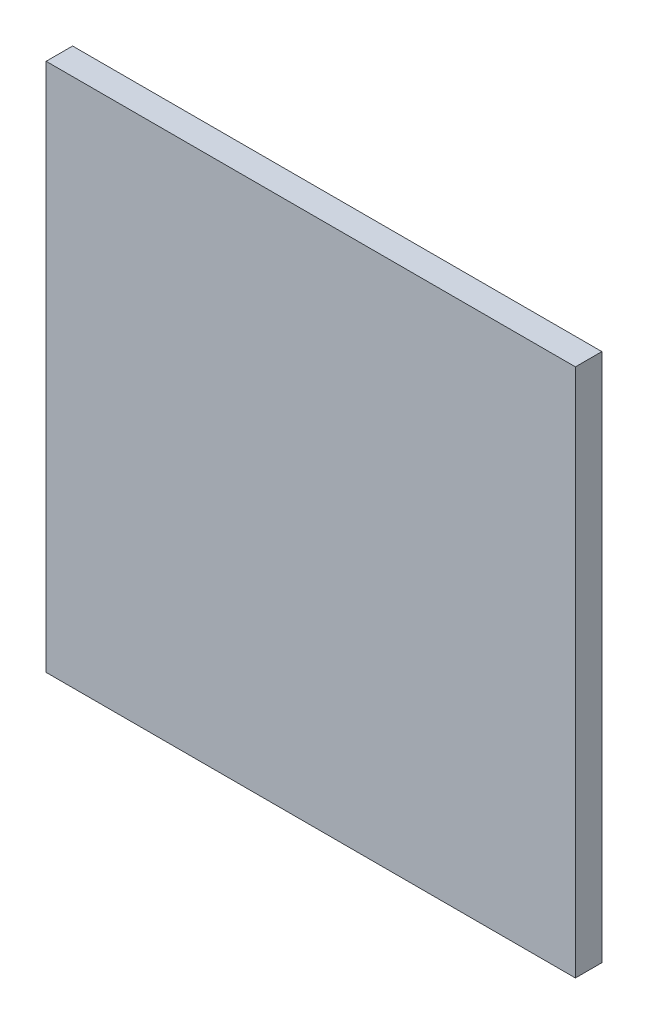
from build123d import *

# Parameters (mm, degrees)
SKETCH1_W      = 20
SKETCH1_H      = 20
EXTRUDE1_DEPTH = 1


with BuildPart() as part:
    # Sketch1 → Extrude1 (new body)
    with BuildSketch(Plane.XY):
        Rectangle(SKETCH1_W, SKETCH1_H)
    extrude(amount=-EXTRUDE1_DEPTH)


solid = part.part
